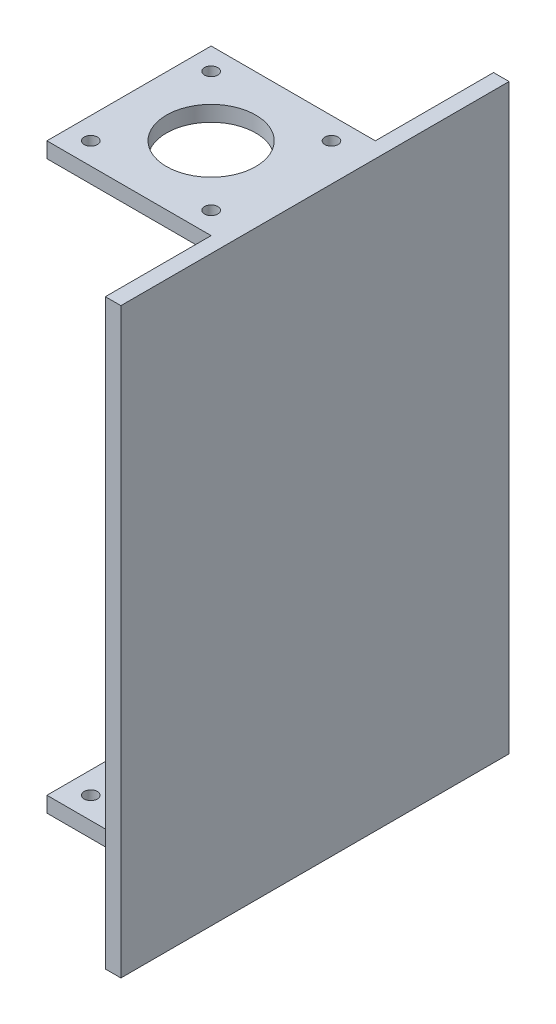
from build123d import *

# Parameters (mm, degrees)
SKETCH2_W           = 42.3
SKETCH2_H           = 42.3
SKETCH2_R           = 1.7
SKETCH2_R_2         = 11.5
BOSS_EXTRUDE1_DEPTH = 4
SKETCH10_W          = 100
SKETCH10_H          = 150
BOSS_EXTRUDE3_DEPTH = 4


with BuildPart() as part:
    # Sketch2 → Boss-Extrude1 (new body)
    with BuildSketch(Plane(origin=(0, 0, 0), x_dir=(1, 0, 0), z_dir=(0, 1, 0))):
        Rectangle(SKETCH2_W, SKETCH2_H)
        with Locations(Location((-15.5, 15.5, 0), (0, 0, 270))):
            Circle(SKETCH2_R, mode=Mode.SUBTRACT)
        with Locations(Location((15.5, 15.5, 0), (0, 0, 270))):
            Circle(SKETCH2_R, mode=Mode.SUBTRACT)
        with Locations(Location((15.5, -15.5, 0), (0, 0, 270))):
            Circle(SKETCH2_R, mode=Mode.SUBTRACT)
        with Locations(Location((-15.5, -15.5, 0), (0, 0, 270))):
            Circle(SKETCH2_R, mode=Mode.SUBTRACT)
        with Locations(Location((0, 0, 0), (0, 0, 270))):
            Circle(SKETCH2_R_2, mode=Mode.SUBTRACT)
    boss_extrude1 = extrude(amount=BOSS_EXTRUDE1_DEPTH)

    # Sketch10 → Boss-Extrude3 (add)
    with BuildSketch(Plane(origin=(21.15, 4, 21.15), x_dir=(0, 0, -1), z_dir=(1, 0, 0))):
        with Locations((22.755859724, -75)):
            Rectangle(SKETCH10_W, SKETCH10_H)
    extrude(amount=BOSS_EXTRUDE3_DEPTH)

    # Mirror1: Boss-Extrude1 across plane
    add(boss_extrude1.mirror(Plane(origin=(0, -71, 0), x_dir=(0, 0, 1), z_dir=(0, -1, 0))))


solid = part.part
